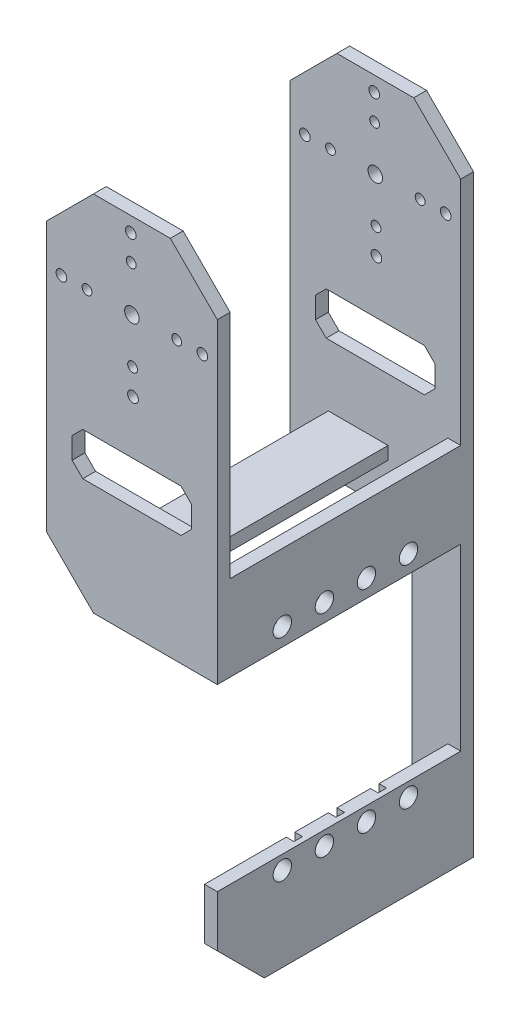
from build123d import *

# Parameters (mm, degrees)
SKETCH_1_W           = 40
SKETCH_1_H           = 60
EXTRUDE_1_DEPTH      = 30
CHAMFER_3_SIZE       = 11
SKETCH_6_W           = 40
SKETCH_6_H           = 54
CUT_EXTRUDE_4_DEPTH  = 80
SKETCH_7_R           = 1.7
CUT_EXTRUDE_5_DEPTH  = 80
SKETCH_9_R           = 1.25
SKETCH_9_R_2         = 1.15
CUT_EXTRUDE_6_DEPTH  = 80
SKETCH_10_W          = 40
SKETCH_10_H          = 3
EXTRUDE_2_DEPTH      = 90
SKETCH_11_W          = 3
SKETCH_11_H          = 20
EXTRUDE_3_DEPTH      = 54
SKETCH_13_W          = 3
SKETCH_13_H          = 27.7
EXTRUDE_4_DEPTH      = 54
SKETCH_12_R          = 2.15
CUT_EXTRUDE_7_DEPTH  = 10
SKETCH_15_W          = 40
SKETCH_15_H          = 42
CUT_EXTRUDE_8_DEPTH  = 80
SKETCH_16_W          = 37
SKETCH_16_H          = 23
CUT_EXTRUDE_9_DEPTH  = 40
SKETCH_17_W          = 2
SKETCH_17_H          = 8.3
CUT_EXTRUDE_10_DEPTH = 1.8
SKETCH_18_W          = 54
SKETCH_18_H          = 3
EXTRUDE_5_DEPTH      = 28
SKETCH_19_W          = 14
SKETCH_19_H          = 54
CUT_EXTRUDE_11_DEPTH = 11.5
CHAMFER_4_SIZE       = 11
SKETCH_24_R          = 1.7
CUT_EXTRUDE_12_DEPTH = 35
SKETCH_25_R          = 1.65
CUT_EXTRUDE_13_DEPTH = 35
CUT_EXTRUDE_14_DEPTH = 65
CUT_EXTRUDE_15_DEPTH = 45
SKETCH_29_W          = 33.502223789
SKETCH_29_H          = 63.386780399
CUT_EXTRUDE_16_DEPTH = 10


with BuildPart() as part:
    # 草图1 → 凸台-拉伸1 (new, symmetric)
    with BuildSketch(Plane.XY):
        Rectangle(SKETCH_1_W, SKETCH_1_H)
    extrude(amount=EXTRUDE_1_DEPTH, both=True)

    # 倒角3
    chamfer_3_edges = [part.edges().sort_by_distance(p)[0] for p in [
        (-20, 30, 0),
        (20, 30, 0),
    ]]
    chamfer(chamfer_3_edges, length=CHAMFER_3_SIZE)

    # 草图6 → 切除-拉伸4 (cut)
    with BuildSketch(Plane(origin=(0, 30, 0), x_dir=(1, 0, 0), z_dir=(0, 1, 0))):
        Rectangle(SKETCH_6_W, SKETCH_6_H)
    extrude(amount=-CUT_EXTRUDE_4_DEPTH, mode=Mode.SUBTRACT)


with BuildPart() as cut_extrude_4_piece_1:
    # of the separate pieces the step leaves, piece 1, a body of its own (cut_extrude_4_pieces)
    add(part.part.solids().sort_by_distance((-20, 19, -27))[0])


with BuildPart() as cut_extrude_4_piece_2:
    # of the separate pieces the step leaves, piece 2, a body of its own (cut_extrude_4_pieces)
    add(part.part.solids().sort_by_distance((-20, 19, 30))[0])


with BuildPart() as cut_extrude_5_tool:
    # 草图7 → 切除-拉伸5 (new body)
    with BuildSketch(Plane.XY.offset(30)):
        with Locations((0, 10)):
            Circle(SKETCH_7_R)
    extrude(amount=-CUT_EXTRUDE_5_DEPTH)


with BuildPart() as cut_extrude_4_piece_1_1:
    add(cut_extrude_4_piece_1.part)

    # 切除-拉伸5: cut by cut_extrude_5_tool
    add(cut_extrude_5_tool.part, mode=Mode.SUBTRACT)


with BuildPart() as cut_extrude_4_piece_2_1:
    add(cut_extrude_4_piece_2.part)

    # 切除-拉伸5: cut by cut_extrude_5_tool
    add(cut_extrude_5_tool.part, mode=Mode.SUBTRACT)


with BuildPart() as cut_extrude_6_tool:
    # 草图9 → 切除-拉伸6 (new body)
    with BuildSketch(Plane.XY.offset(30)):
        with Locations((-16.497956308, 9.740312384)):
            Circle(SKETCH_9_R)
        with Locations((-10.498699469, 9.834744245)):
            Circle(SKETCH_9_R_2)
        with Locations((-0.165255755, 20.498699469)):
            Circle(SKETCH_9_R_2)
        with Locations((-0.259687616, 26.497956308)):
            Circle(SKETCH_9_R)
        with Locations((10.498699469, 10.165255755)):
            Circle(SKETCH_9_R_2)
        with Locations((16.497956308, 10.259687616)):
            Circle(SKETCH_9_R)
        with Locations((0.165255755, -0.498699469)):
            Circle(SKETCH_9_R_2)
        with Locations((0.259687616, -6.497956308)):
            Circle(SKETCH_9_R)
    extrude(amount=-CUT_EXTRUDE_6_DEPTH)


with BuildPart() as cut_extrude_4_piece_1_2:
    add(cut_extrude_4_piece_1_1.part)

    # 切除-拉伸6: cut by cut_extrude_6_tool
    add(cut_extrude_6_tool.part, mode=Mode.SUBTRACT)



with BuildPart() as cut_extrude_4_piece_2_2:
    add(cut_extrude_4_piece_2_1.part)

    # 切除-拉伸6: cut by cut_extrude_6_tool
    add(cut_extrude_6_tool.part, mode=Mode.SUBTRACT)


with BuildPart() as cut_extrude_4_piece_1_3:
    add(cut_extrude_4_piece_1_2.part)

    add(cut_extrude_4_piece_2_2.part)  # 凸台-拉伸2 merges 切除-拉伸4 piece 2
    # 草图10 → 凸台-拉伸2 (add)
    with BuildSketch(Plane.XZ.offset(30)):
        with Locations((0, 28.5)):
            Rectangle(SKETCH_10_W, SKETCH_10_H)
        with Locations((0, -28.5)):
            Rectangle(SKETCH_10_W, SKETCH_10_H)
    extrude(amount=EXTRUDE_2_DEPTH)

    # 草图11 → 凸台-拉伸3 (add)
    with BuildSketch(Plane.XY.offset(-27)):
        with Locations((18.5, -45)):
            Rectangle(SKETCH_11_W, SKETCH_11_H)
    extrude(amount=EXTRUDE_3_DEPTH)

    # 草图13 → 凸台-拉伸4 (add)
    with BuildSketch(Plane.XY.offset(-27)):
        with Locations((18.5, -106.15)):
            Rectangle(SKETCH_13_W, SKETCH_13_H)
    extrude(amount=EXTRUDE_4_DEPTH)

    # 草图12 → 切除-拉伸7 (cut)
    with BuildSketch(Plane(origin=(20, 0, 0), x_dir=(0, 0, -1), z_dir=(1, 0, 0))):
        with Locations((-14.775, -50.85)):
            Circle(SKETCH_12_R)
        with Locations((-4.925, -50.85)):
            Circle(SKETCH_12_R)
        with Locations((-14.775, -100.27)):
            Circle(SKETCH_12_R)
        with Locations((-4.925, -100.27)):
            Circle(SKETCH_12_R)
        with Locations((4.925, -100.27)):
            Circle(SKETCH_12_R)
        with Locations((14.775, -100.27)):
            Circle(SKETCH_12_R)
        with Locations(Location((4.925, -50.85, 0), (0, 0, 90))):
            Circle(SKETCH_12_R)
        with Locations(Location((14.775, -50.85, 0), (0, 0, 90))):
            Circle(SKETCH_12_R)
    extrude(amount=-CUT_EXTRUDE_7_DEPTH, mode=Mode.SUBTRACT)

    # 草图15 → 切除-拉伸8 (cut)
    with BuildSketch(Plane.XY.offset(-27)):
        with Locations((0, -76)):
            Rectangle(SKETCH_15_W, SKETCH_15_H)
    extrude(amount=CUT_EXTRUDE_8_DEPTH, mode=Mode.SUBTRACT)

    # 草图16 → 切除-拉伸9 (cut)
    with BuildSketch(Plane(origin=(0, 0, 27), x_dir=(-1, 0, 0), z_dir=(0, 0, -1))):
        with Locations((1.5, -108.5)):
            Rectangle(SKETCH_16_W, SKETCH_16_H)
    extrude(amount=-CUT_EXTRUDE_9_DEPTH, mode=Mode.SUBTRACT)

    # 草图17 → 切除-拉伸10 (cut)
    with BuildSketch(Plane.ZY.offset(-17)):
        with Locations((0, -50.85)):
            Rectangle(SKETCH_17_W, SKETCH_17_H)
        with Locations((-9.85, -50.85)):
            Rectangle(SKETCH_17_W, SKETCH_17_H)
        with Locations((9.85, -50.85)):
            Rectangle(SKETCH_17_W, SKETCH_17_H)
        with Locations((9.85, -101.15)):
            Rectangle(SKETCH_17_W, SKETCH_17_H)
        with Locations((-9.85, -101.15)):
            Rectangle(SKETCH_17_W, SKETCH_17_H)
        with Locations((0, -101.15)):
            Rectangle(SKETCH_17_W, SKETCH_17_H)
    extrude(amount=-CUT_EXTRUDE_10_DEPTH, mode=Mode.SUBTRACT)

    # 草图18 → 凸台-拉伸5 (add)
    with BuildSketch(Plane.ZY.offset(-17)):
        with Locations((0, -45)):
            Rectangle(SKETCH_18_W, SKETCH_18_H)
    extrude(amount=EXTRUDE_5_DEPTH)

    # 草图19 → 切除-拉伸11 (cut)
    with BuildSketch(Plane(origin=(0, -43.5, 0), x_dir=(1, 0, 0), z_dir=(0, 1, 0))):
        with Locations((10, 0)):
            Rectangle(SKETCH_19_W, SKETCH_19_H)
    extrude(amount=-CUT_EXTRUDE_11_DEPTH, mode=Mode.SUBTRACT)

    # 倒角4
    chamfer_4_edges = [cut_extrude_4_piece_1_3.edges().sort_by_distance(p)[0] for p in [
        (-20, -55, 28.5),
        (18.5, -120, 30),
        (-20, -120, -28.5),
    ]]
    chamfer(chamfer_4_edges, length=CHAMFER_4_SIZE)

    # 草图24 → 切除-拉伸12 (cut)
    with BuildSketch(Plane.XY.offset(-27)):
        with Locations((-14, -79)):
            Circle(SKETCH_24_R)
        with Locations((-14, -89)):
            Circle(SKETCH_24_R)
    extrude(amount=-CUT_EXTRUDE_12_DEPTH, mode=Mode.SUBTRACT)

    # 草图25 → 切除-拉伸13 (cut)
    with BuildSketch(Plane.XY.offset(-27)):
        with Locations((3, -116)):
            Circle(SKETCH_25_R)
        with Locations((13, -116)):
            Circle(SKETCH_25_R)
    extrude(amount=-CUT_EXTRUDE_13_DEPTH, mode=Mode.SUBTRACT)

    # 草图27 → 切除-拉伸14 (cut)
    with BuildSketch(Plane(origin=(0, 0, -30), x_dir=(-1, 0, 0), z_dir=(0, 0, -1))):
        Polygon((-14, -21.5), (-11.5, -19), (11.5, -19), (14, -21.5), (14, -26.5), (11.5, -29), (-11.5, -29), (-14, -26.5), align=None)
    extrude(amount=-CUT_EXTRUDE_14_DEPTH, mode=Mode.SUBTRACT)

    # 草图28 → 切除-拉伸15 (cut)
    with BuildSketch(Plane(origin=(0, 0, -30), x_dir=(-1, 0, 0), z_dir=(0, 0, -1))):
        Polygon((-4, -105), (-1, -105), (-1, -81), (-4, -81), (-7, -84), (-7, -102), align=None)
        Polygon((7.5, -70), (9.5, -70), (12.5, -67), (12.5, -51), (9.5, -48), (7.5, -48), align=None)
    extrude(amount=-CUT_EXTRUDE_15_DEPTH, mode=Mode.SUBTRACT)

    # 草图29 → 切除-拉伸16 (cut)
    with BuildSketch(Plane.XY.offset(-27)):
        with Locations((-8.200271599, -88.306609801)):
            Rectangle(SKETCH_29_W, SKETCH_29_H)
    extrude(amount=-CUT_EXTRUDE_16_DEPTH, mode=Mode.SUBTRACT)


solid = cut_extrude_4_piece_1_3.part
